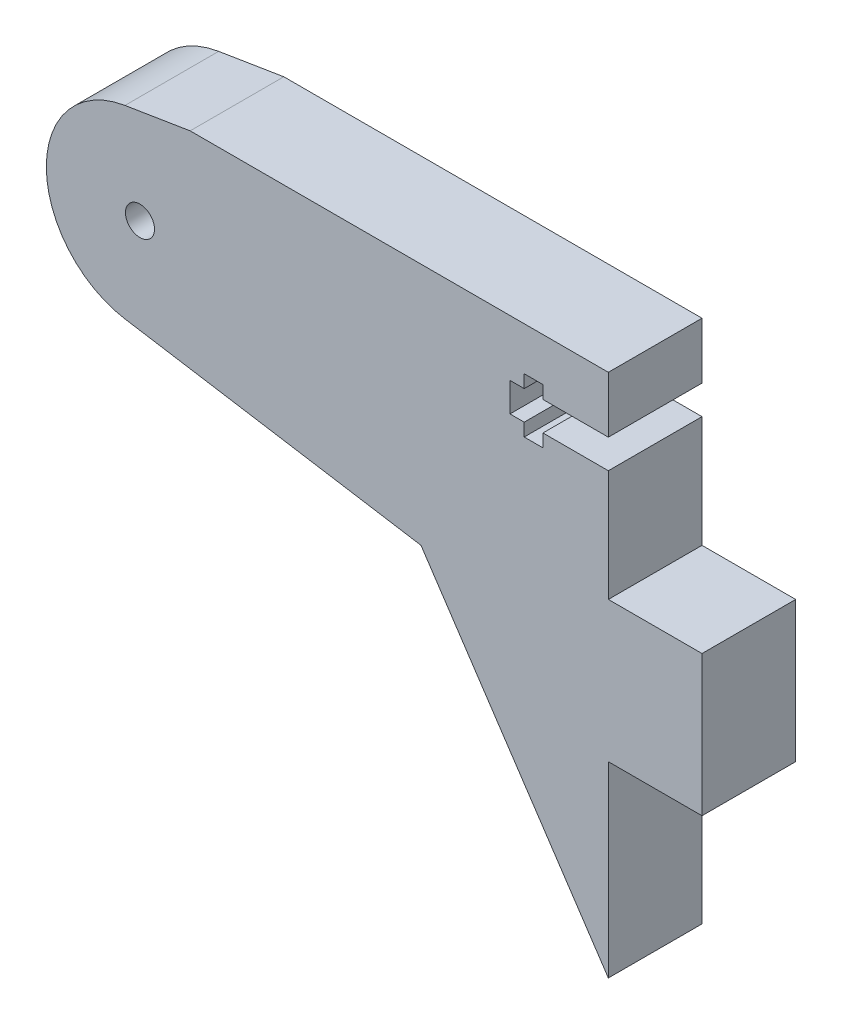
from build123d import *

# Parameters (mm, degrees)
DODANIE_WYCI_GNI_CIE1_DEPTH = 10
SZKIC2_R                    = 1.55
WYTNIJ_WYCI_GNI_CIE1_DEPTH  = 10
SZKIC3_W                    = 10
SZKIC3_H                    = 20
SZKIC3_H_2                  = 25
WYTNIJ_WYCI_GNI_CIE2_DEPTH  = 10
WYTNIJ_WYCI_GNI_CIE3_DEPTH  = 10
SZKIC5_W                    = 44.64499878
SZKIC5_H                    = 4
WYTNIJ_WYCI_GNI_CIE4_DEPTH  = 10


with BuildPart() as part:
    # Szkic1 → Dodanie-wyciągnięcie1 (new body)
    with BuildSketch(Plane.XY):
        with BuildLine():
            Line((-437.064585695, -68.955768861), (-437.064585695, -98.955768861))
            Line((-437.064585695, -98.955768861), (-437.064585695, -128.955768861))
            Line((-437.064585695, -128.955768861), (-447.064585695, -128.955768861))
            Line((-447.064585695, -128.955768861), (-467.064585695, -98.955768861))
            Line((-467.064585695, -98.955768861), (-498.66666852, -93.826601178))
            ThreePointArc((-498.66666852, -93.826601178), (-507.064585695, -83.955768861), (-498.66666852, -74.084936545))
            Line((-498.66666852, -74.084936545), (-467.064585695, -68.955768861))
            Line((-467.064585695, -68.955768861), (-437.064585695, -68.955768861))
        make_face()
    extrude(amount=DODANIE_WYCI_GNI_CIE1_DEPTH)

    # Szkic2 → Wytnij-wyciągnięcie1 (cut)
    with BuildSketch(Plane.XY.offset(10)):
        with Locations((-497.064585695, -83.955768861)):
            Circle(SZKIC2_R)
    extrude(amount=-WYTNIJ_WYCI_GNI_CIE1_DEPTH, mode=Mode.SUBTRACT)

    # Szkic3 → Wytnij-wyciągnięcie2 (cut)
    with BuildSketch(Plane(origin=(0, 0, 0), x_dir=(-1, 0, 0), z_dir=(0, 0, -1))):
        with Locations((442.064585695, -118.955768861)):
            Rectangle(SZKIC3_W, SZKIC3_H)
        with Locations((442.064585695, -81.455768861)):
            Rectangle(SZKIC3_W, SZKIC3_H_2)
    extrude(amount=-WYTNIJ_WYCI_GNI_CIE2_DEPTH, mode=Mode.SUBTRACT)

    # Szkic4 → Wytnij-wyciągnięcie3 (cut)
    with BuildSketch(Plane(origin=(0, 0, 0), x_dir=(-1, 0, 0), z_dir=(0, 0, -1))):
        Polygon((447.064585695, -78.955768861), (447.064585695, -82.055768861), (454.046285695, -82.055768861), (454.046285695, -83.430768861), (456.046285695, -83.430768861), (456.046285695, -82.055768861), (457.564585695, -82.055768861), (457.564585695, -78.955768861), (456.046285695, -78.955768861), (456.046285695, -77.580768861), (454.046285695, -77.580768861), (454.046285695, -78.955768861), align=None)
    extrude(amount=-WYTNIJ_WYCI_GNI_CIE3_DEPTH, mode=Mode.SUBTRACT)

    # Szkic5 → Wytnij-wyciągnięcie4 (cut)
    with BuildSketch(Plane(origin=(0, 0, 0), x_dir=(-1, 0, 0), z_dir=(0, 0, -1))):
        with Locations((469.387085085, -70.955768861)):
            Rectangle(SZKIC5_W, SZKIC5_H)
    extrude(amount=-WYTNIJ_WYCI_GNI_CIE4_DEPTH, mode=Mode.SUBTRACT)


solid = part.part
